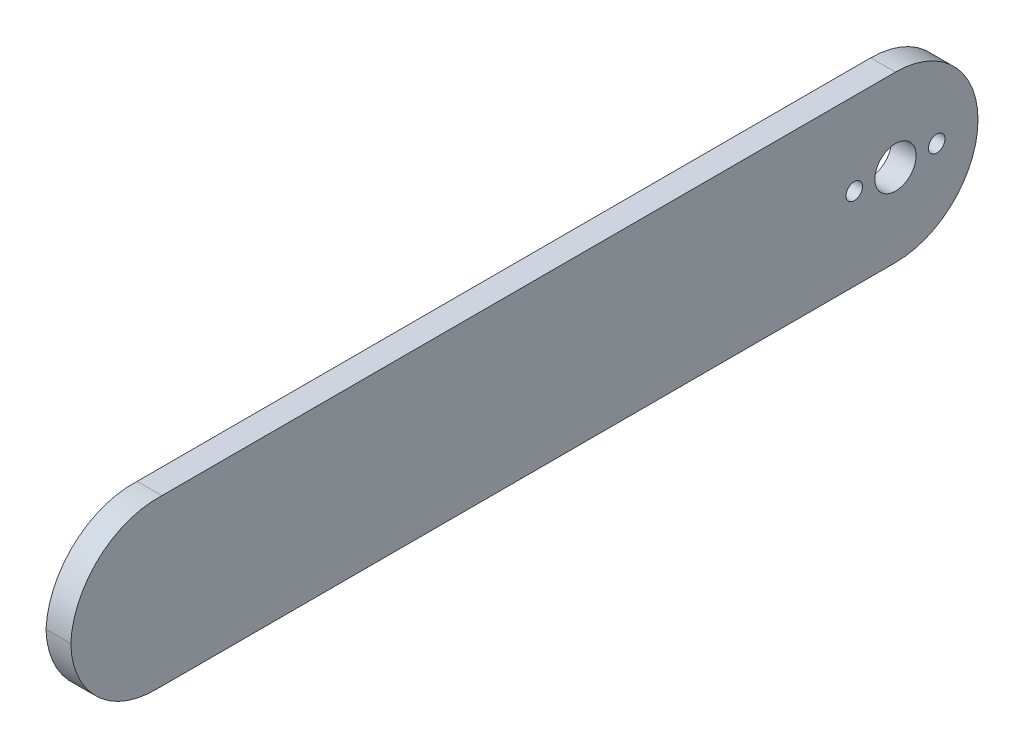
from build123d import *

# Parameters (mm, degrees)
SKETCH1_R           = 2.5
SKETCH1_R_2         = 1
BOSS_EXTRUDE1_DEPTH = 3


with BuildPart() as part:
    # Sketch1 → Boss-Extrude1 (new body)
    with BuildSketch(Plane(origin=(0, 0, 0), x_dir=(0, 0, -1), z_dir=(1, 0, 0))):
        with BuildLine():
            Line((-81.371714004, 9.04040404), (7.575757576, 9.04040404))
            ThreePointArc((7.575757576, 9.04040404), (14.646825388, 6.111471852), (17.575757576, -0.95959596))
            ThreePointArc((17.575757576, -0.95959596), (14.646825388, -8.030663771), (7.575757576, -10.95959596))
            Line((7.575757576, -10.95959596), (-81.897978214, -10.95959596))
            ThreePointArc((-81.897978214, -10.95959596), (-89.232178131, -8.139656658), (-92.424242424, -0.95959596))
            ThreePointArc((-92.424242424, -0.95959596), (-88.969046026, 6.329457626), (-81.371714004, 9.04040404))
        make_face()
        with Locations((7.575757576, -0.95959596)):
            Circle(SKETCH1_R, mode=Mode.SUBTRACT)
        with Locations((12.575757576, -0.95959596)):
            Circle(SKETCH1_R_2, mode=Mode.SUBTRACT)
        with Locations((2.575757576, -0.95959596)):
            Circle(SKETCH1_R_2, mode=Mode.SUBTRACT)
    extrude(amount=BOSS_EXTRUDE1_DEPTH)


solid = part.part
